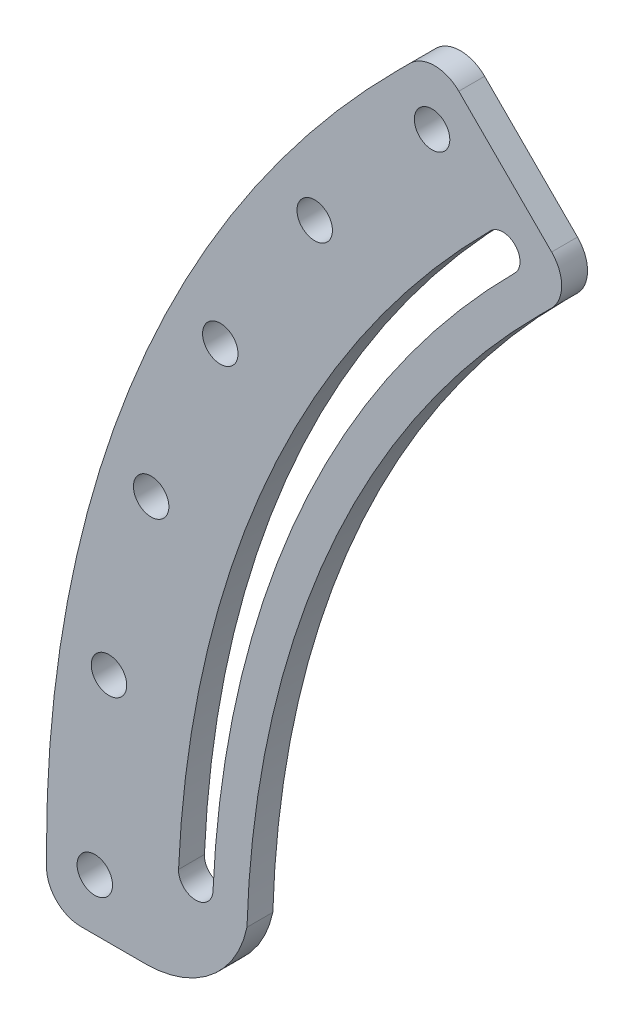
from build123d import *

# Parameters (mm, degrees)
SKETCH1_R           = 3.2639
BOSS_EXTRUDE1_DEPTH = 4.7625
CUT_EXTRUDE4_DEPTH  = 274.082391315


with BuildPart() as part:
    # Sketch1 → Boss-Extrude1 (new body)
    with BuildSketch(Plane.XY):
        with BuildLine():
            Line((-220.98, 0), (-220.98, -3.2004))
            ThreePointArc((-220.98, -3.2004), (-219.127567548, -7.672567548), (-214.6554, -9.525))
            Line((-214.6554, -9.525), (-190.4746, -9.525))
            ThreePointArc((-190.4746, -9.525), (-186.002432452, -7.672567548), (-184.15, -3.2004))
            Line((-184.15, -3.2004), (-184.15, 0))
            ThreePointArc((-184.15, 0), (-170.132415912, 70.47115407), (-130.213713756, 130.213713756))
            Line((-130.213713756, 130.213713756), (-127.950689213, 132.476738298))
            ThreePointArc((-127.950689213, 132.476738298), (-126.098256761, 136.948905846), (-127.950689213, 141.421073395))
            Line((-127.950689213, 141.421073395), (-145.049096868, 158.519481049))
            ThreePointArc((-145.049096868, 158.519481049), (-149.521264416, 160.371913501), (-153.993431964, 158.519481049))
            Line((-153.993431964, 158.519481049), (-156.256456507, 156.256456507))
            ThreePointArc((-156.256456507, 156.256456507), (-204.158899094, 84.565384884), (-220.98, 0))
        make_face()
        with Locations(Location((-212.09, 0, 0), (0, 0, 180))):
            Circle(SKETCH1_R, mode=Mode.SUBTRACT)
        with Locations(Location((-209.478820157, 33.17818569, 0), (0, 0, 180))):
            Circle(SKETCH1_R, mode=Mode.SUBTRACT)
        with Locations(Location((-201.709576541, 65.539414337, 0), (0, 0, 180))):
            Circle(SKETCH1_R, mode=Mode.SUBTRACT)
        with Locations(Location((-188.973573715, 96.28684509, 0), (0, 0, 180))):
            Circle(SKETCH1_R, mode=Mode.SUBTRACT)
        with Locations(Location((-171.584414337, 124.663374159, 0), (0, 0, 180))):
            Circle(SKETCH1_R, mode=Mode.SUBTRACT)
        with Locations(Location((-149.970277222, 149.970277222, 0), (0, 0, 180))):
            Circle(SKETCH1_R, mode=Mode.SUBTRACT)
        with BuildLine():
            ThreePointArc((-190.318686211, 8.309493293), (-174.366836772, 76.723244418), (-134.703841816, 134.703841816))
            ThreePointArc((-134.703841816, 134.703841816), (-134.703841816, 139.193969877), (-139.193969877, 139.193969877))
            ThreePointArc((-139.193969877, 139.193969877), (-180.179064665, 79.280685899), (-196.662642418, 8.586476403))
            ThreePointArc((-196.662642418, 8.586476403), (-193.62915587, 5.276006744), (-190.318686211, 8.309493293))
        make_face(mode=Mode.SUBTRACT)
    extrude(amount=BOSS_EXTRUDE1_DEPTH)

    # Sketch2 → Cut-Extrude4 (cut, through all)
    with BuildSketch(Plane.XY):
        with BuildLine():
            Line((-202.7174, -9.525), (-183.6674, -9.525))
            Line((-183.6674, -9.525), (-183.6674, 9.525))
            ThreePointArc((-183.6674, 9.525), (-189.247015818, -3.945384182), (-202.7174, -9.525))
        make_face()
    extrude(amount=CUT_EXTRUDE4_DEPTH, mode=Mode.SUBTRACT)


solid = part.part
